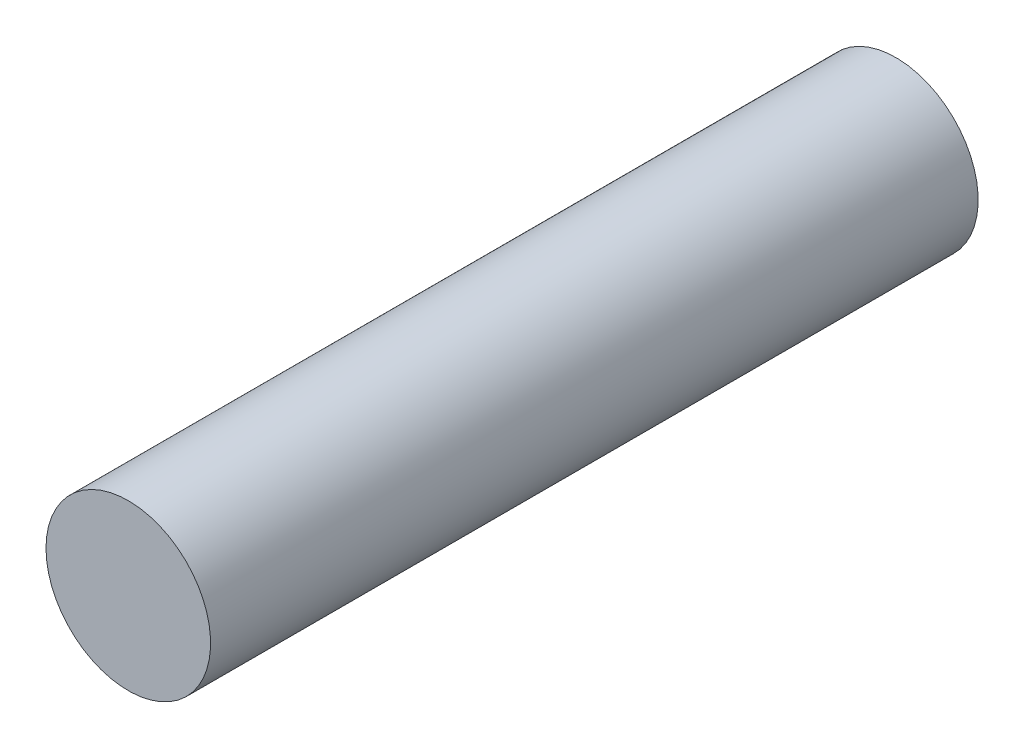
from build123d import *

# Parameters (mm, degrees)
SKETCH1_R           = 9.65
BOSS_EXTRUDE1_DEPTH = 90
SCALE1_SCALE        = 1.5


with BuildPart() as part:
    # Sketch1 → Boss-Extrude1 (new body)
    with BuildSketch(Plane.XY):
        with Locations(Location((0, 0, 0), (0, 0, 180))):
            Circle(SKETCH1_R)
    extrude(amount=BOSS_EXTRUDE1_DEPTH)


with BuildPart() as part_1:
    # Scale1: scaled about (0, 0, 45)
    add(part.part.scale(SCALE1_SCALE).moved(Location((0, 0, -22.5))))


solid = part_1.part
